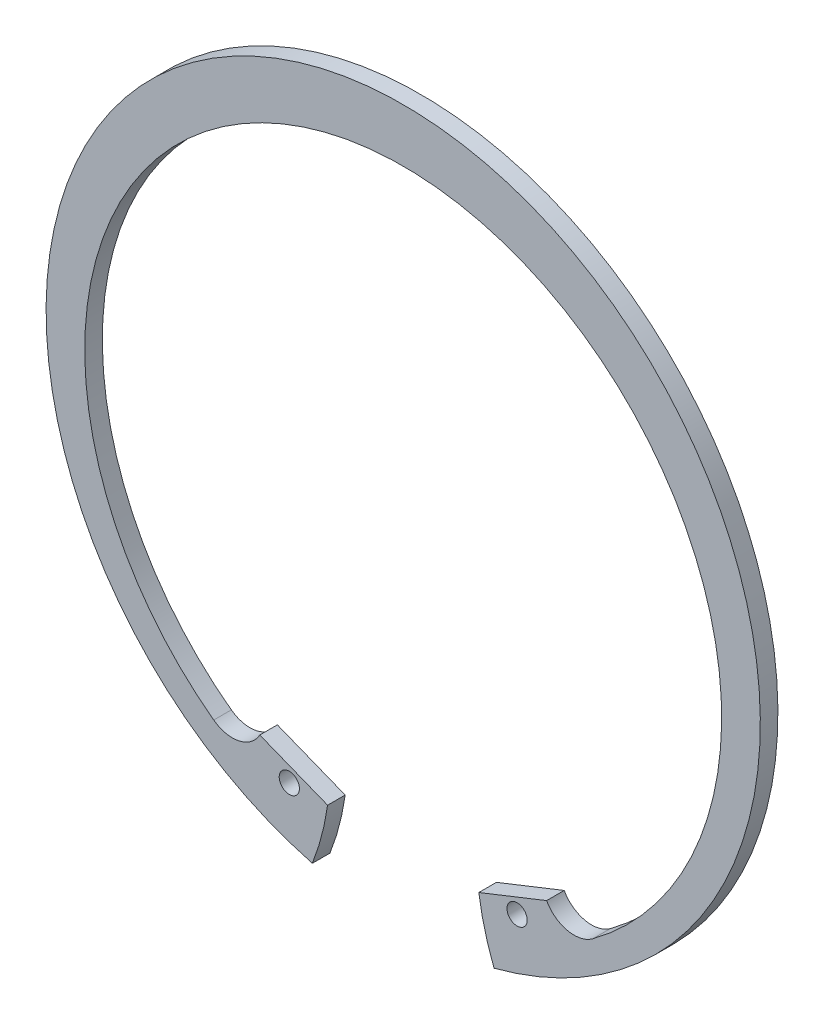
from build123d import *

# Parameters (mm, degrees)
BOSS_EXTRUDE1_DEPTH      = 1.3843
BOSS_EXTRUDE1_DEPTH_BACK = 1.3843
SKETCH3_R                = 1.5875
CUT_EXTRUDE1_DEPTH       = 80.469363836


with BuildPart() as part:
    # Sketch3 → Boss-Extrude1 (new, two sides: drawn at the far end of the back side and taken through both)
    with BuildSketch(Plane.XY.offset(-BOSS_EXTRUDE1_DEPTH_BACK)):
        with BuildLine():
            Line((-14.000446906, -54.412491557), (-11.6586, -45.310944597))
            Line((-11.6586, -45.310944597), (-22.563343702, -40.986585308))
            ThreePointArc((-22.563343702, -40.986585308), (-25.826143446, -43.422866993), (-29.807849675, -42.570021098))
            ThreePointArc((-29.807849675, -42.570021098), (0, 47.8028), (29.807849675, -42.570021098))
            ThreePointArc((29.807849675, -42.570021098), (25.826143446, -43.422866993), (22.563343702, -40.986585308))
            Line((22.563343702, -40.986585308), (11.6586, -45.310944597))
            Line((11.6586, -45.310944597), (14.000446906, -54.412491557))
            ThreePointArc((14.000446906, -54.412491557), (0, 56.1848), (-14.000446906, -54.412491557))
        make_face()
        with Locations((-17.918699662, -45.185613459)):
            Circle(SKETCH3_R, mode=Mode.SUBTRACT)
        with Locations(Location((17.918699662, -45.185613459, 0), (0, 0, 180))):
            Circle(SKETCH3_R, mode=Mode.SUBTRACT)
    extrude(amount=BOSS_EXTRUDE1_DEPTH + BOSS_EXTRUDE1_DEPTH_BACK)

    # Sketch4 → Cut-Extrude1 (cut, symmetric)
    with BuildSketch(Plane.XY):
        with BuildLine():
            Line((-14.293507369, -54.336243872), (-14.293507369, -68.629751241))
            Line((-14.293507369, -68.629751241), (0, -68.629751241))
            Line((0, -68.629751241), (0, -56.1848))
            Line((0, -56.1848), (0, -45.21731246))
            Line((0, -45.21731246), (-11.89471231, -45.21731246))
            ThreePointArc((-11.89471231, -45.21731246), (-12.826392835, -49.84720289), (-14.293507369, -54.336243872))
        make_face()
    cut_extrude1 = extrude(amount=CUT_EXTRUDE1_DEPTH, both=True, mode=Mode.SUBTRACT)

    # Mirror1: Cut-Extrude1 across plane
    add(cut_extrude1.mirror(Plane(origin=(0, 0, 0), x_dir=(0, 0, 1), z_dir=(1, 0, 0))), mode=Mode.SUBTRACT)


solid = part.part
